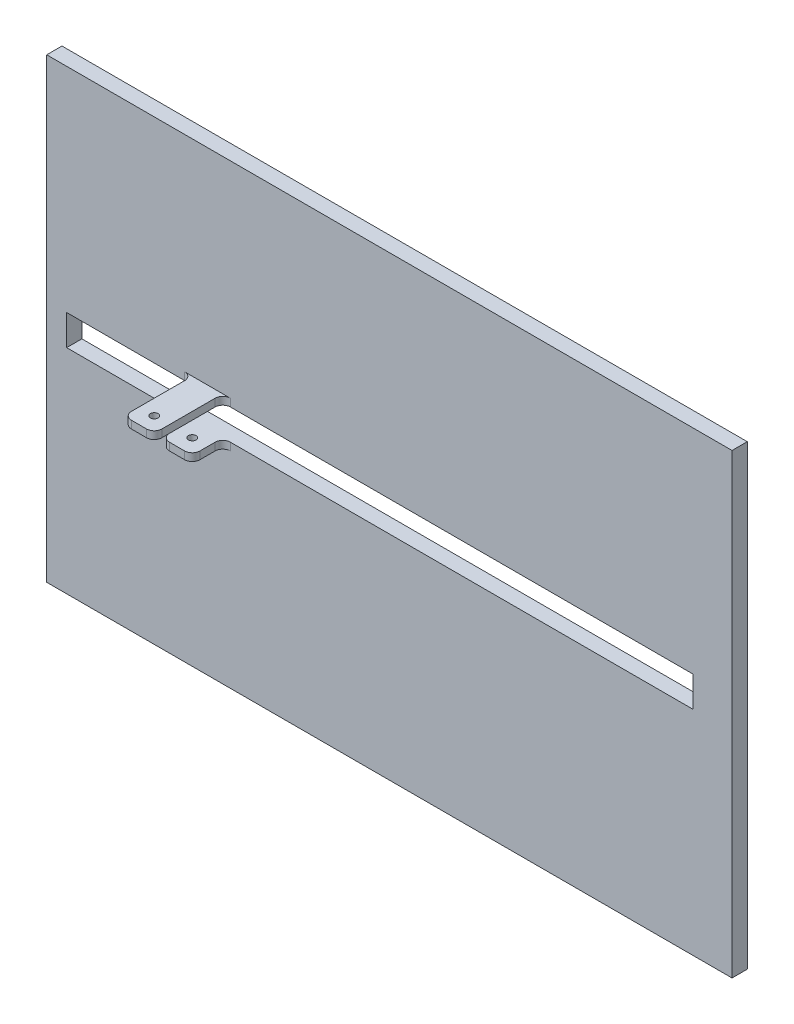
from build123d import *

# Parameters (mm, degrees)
SKETCH1_W           = 1300
SKETCH1_H           = 600
SKETCH1_W_2         = 1117.676372874
SKETCH1_H_2         = 40
BOSS_EXTRUDE1_DEPTH = 20
SKETCH2_W           = 40
SKETCH2_H           = 10
BOSS_EXTRUDE2_DEPTH = 40
SKETCH3_R           = 5
CUT_EXTRUDE1_DEPTH  = 10
SKETCH4_W           = 40
SKETCH4_H           = 10
BOSS_EXTRUDE3_DEPTH = 50
SKETCH5_R           = 5
CUT_EXTRUDE2_DEPTH  = 10
FILLET1_R           = 10
FILLET2_R           = 10
FILLET3_R           = 10
FILLET4_R           = 10
FILLET5_R           = 10
FILLET6_R           = 10
FILLET7_R           = 10
FILLET8_R           = 10
SKETCH6_W           = 20
SKETCH6_H           = 40
BOSS_EXTRUDE4_DEPTH = 260
SKETCH7_W           = 20
SKETCH7_H           = 40
BOSS_EXTRUDE5_DEPTH = 35
SKETCH8_W           = 20
SKETCH8_H           = 600
CUT_EXTRUDE3_DEPTH  = 100
SKETCH9_W           = 20
SKETCH9_H           = 600
CUT_EXTRUDE4_DEPTH  = 300


with BuildPart() as part:
    # Sketch1 → Boss-Extrude1 (new body)
    with BuildSketch(Plane.XY):
        Rectangle(SKETCH1_W, SKETCH1_H)
        Rectangle(SKETCH1_W_2, SKETCH1_H_2, mode=Mode.SUBTRACT)
    extrude(amount=BOSS_EXTRUDE1_DEPTH)

    # Sketch2 → Boss-Extrude2 (add)
    with BuildSketch(Plane.XY.offset(20)):
        with Locations((-338.838186437, 25)):
            Rectangle(SKETCH2_W, SKETCH2_H)
        with Locations((-338.838186437, -25)):
            Rectangle(SKETCH2_W, SKETCH2_H)
    extrude(amount=BOSS_EXTRUDE2_DEPTH)

    # Sketch3 → Cut-Extrude1 (cut)
    with BuildSketch(Plane.XZ.offset(30)):
        with Locations((-338.838186437, 40)):
            Circle(SKETCH3_R)
    extrude(amount=-CUT_EXTRUDE1_DEPTH, mode=Mode.SUBTRACT)

    # Sketch4 → Boss-Extrude3 (add)
    with BuildSketch(Plane.XY.offset(60)):
        with Locations((-338.838186437, 25)):
            Rectangle(SKETCH4_W, SKETCH4_H)
    extrude(amount=BOSS_EXTRUDE3_DEPTH)

    # Sketch5 → Cut-Extrude2 (cut)
    with BuildSketch(Plane.XZ.offset(-20)):
        with Locations(Location((-338.838186437, 90, 0), (0, 0, 270))):
            Circle(SKETCH5_R)
    extrude(amount=-CUT_EXTRUDE2_DEPTH, mode=Mode.SUBTRACT)

    # Fillet1
    fillet1_edges = [part.edges().sort_by_distance(p)[0] for p in [
        (-318.838186437, -25, 20),
    ]]
    fillet(fillet1_edges, radius=FILLET1_R)

    # Fillet2
    fillet2_edges = [part.edges().sort_by_distance(p)[0] for p in [
        (-318.838186437, 25, 20),
    ]]
    fillet(fillet2_edges, radius=FILLET2_R)

    # Fillet3
    fillet3_edges = [part.edges().sort_by_distance(p)[0] for p in [
        (-358.838186437, -25, 20),
    ]]
    fillet(fillet3_edges, radius=FILLET3_R)

    # Fillet4
    fillet4_edges = [part.edges().sort_by_distance(p)[0] for p in [
        (-358.838186437, 25, 20),
    ]]
    fillet(fillet4_edges, radius=FILLET4_R)

    # Fillet5
    fillet5_edges = [part.edges().sort_by_distance(p)[0] for p in [
        (-318.838186437, -25, 60),
    ]]
    fillet(fillet5_edges, radius=FILLET5_R)

    # Fillet6
    fillet6_edges = [part.edges().sort_by_distance(p)[0] for p in [
        (-358.838186437, -25, 60),
    ]]
    fillet(fillet6_edges, radius=FILLET6_R)

    # Fillet7
    fillet7_edges = [part.edges().sort_by_distance(p)[0] for p in [
        (-358.838186437, 25, 110),
    ]]
    fillet(fillet7_edges, radius=FILLET7_R)

    # Fillet8
    fillet8_edges = [part.edges().sort_by_distance(p)[0] for p in [
        (-318.838186437, 25, 110),
    ]]
    fillet(fillet8_edges, radius=FILLET8_R)

    # Sketch6 → Boss-Extrude4 (add)
    with BuildSketch(Plane.ZY.offset(-558.838186437)):
        with Locations((10, 0)):
            Rectangle(SKETCH6_W, SKETCH6_H)
    extrude(amount=BOSS_EXTRUDE4_DEPTH)

    # Sketch7 → Boss-Extrude5 (add)
    with BuildSketch(Plane(origin=(-558.838186437, 0, 0), x_dir=(0, 0, -1), z_dir=(1, 0, 0))):
        with Locations((-10, 0)):
            Rectangle(SKETCH7_W, SKETCH7_H)
    extrude(amount=BOSS_EXTRUDE5_DEPTH)

    # Sketch8 → Cut-Extrude3 (cut)
    with BuildSketch(Plane.ZY.offset(650)):
        with Locations((10, 0)):
            Rectangle(SKETCH8_W, SKETCH8_H)
    extrude(amount=-CUT_EXTRUDE3_DEPTH, mode=Mode.SUBTRACT)

    # Sketch9 → Cut-Extrude4 (cut)
    with BuildSketch(Plane(origin=(650, 0, 0), x_dir=(0, 0, -1), z_dir=(1, 0, 0))):
        with Locations((-10, 0)):
            Rectangle(SKETCH9_W, SKETCH9_H)
    extrude(amount=-CUT_EXTRUDE4_DEPTH, mode=Mode.SUBTRACT)


solid = part.part
